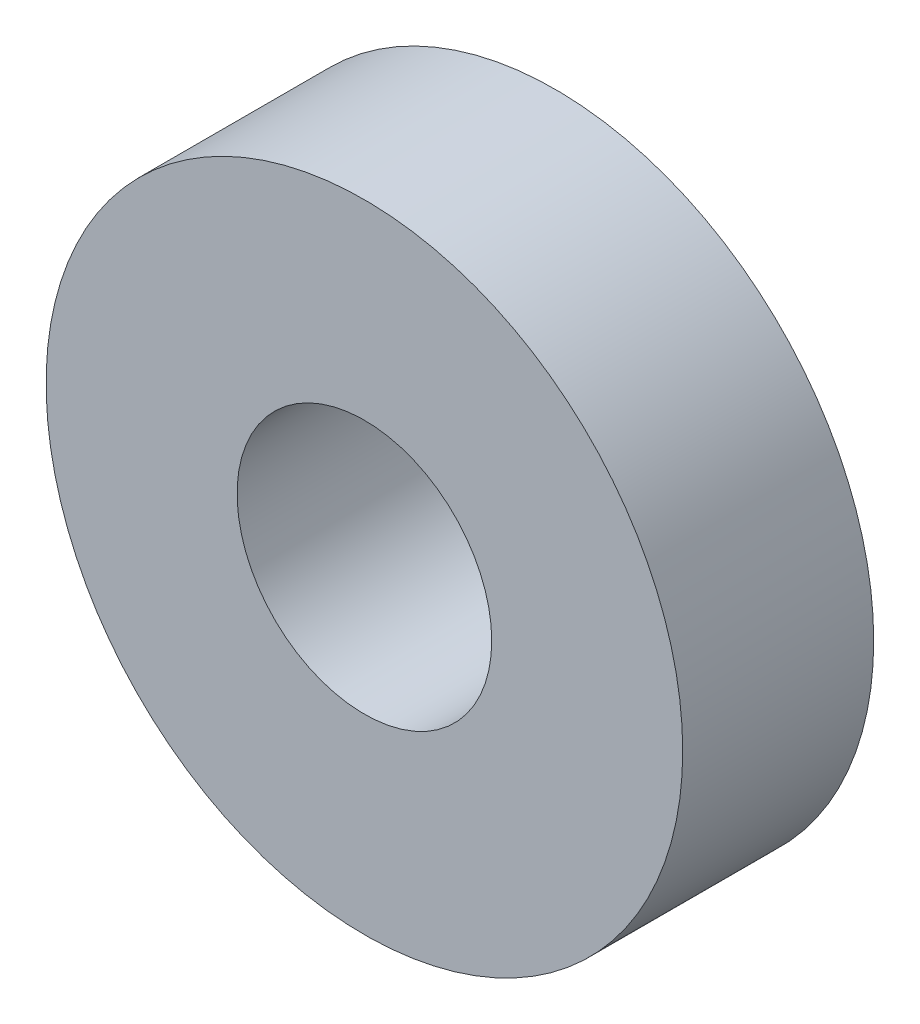
from build123d import *

# Parameters (mm, degrees)
SKETCH_1_R      = 2.5
SKETCH_1_R_2    = 1
EXTRUDE_1_DEPTH = 1.5


with BuildPart() as part:
    # 草图1 → 凸台-拉伸1 (new body)
    with BuildSketch(Plane.XY):
        Circle(SKETCH_1_R)
        Circle(SKETCH_1_R_2, mode=Mode.SUBTRACT)
    extrude(amount=EXTRUDE_1_DEPTH)


solid = part.part
